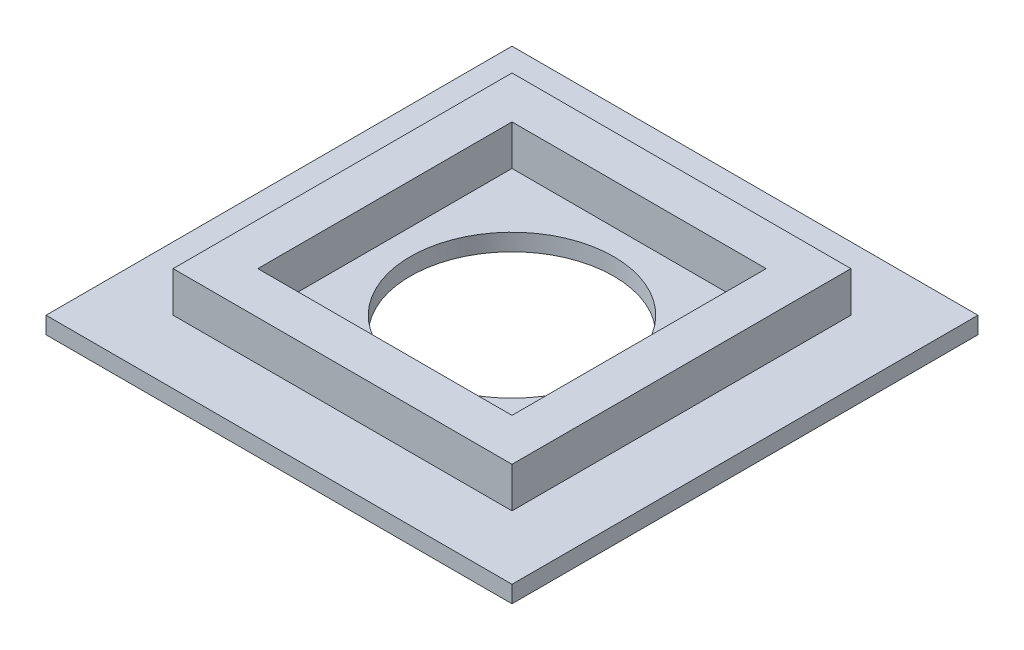
from build123d import *

# Parameters (mm, degrees)
SKETCH1_W           = 110
SKETCH1_H           = 110
BOSS_EXTRUDE1_DEPTH = 4
SKETCH2_W           = 80
SKETCH2_H           = 80
SKETCH2_W_2         = 60
SKETCH2_H_2         = 60
BOSS_EXTRUDE2_DEPTH = 9.525
SKETCH3_R           = 24.000000006
CUT_EXTRUDE1_DEPTH  = 20


with BuildPart() as part:
    # Sketch1 → Boss-Extrude1 (new body)
    with BuildSketch(Plane(origin=(0, 0, 0), x_dir=(1, 0, 0), z_dir=(0, 1, 0))):
        Rectangle(SKETCH1_W, SKETCH1_H)
    extrude(amount=-BOSS_EXTRUDE1_DEPTH)

    # Sketch2 → Boss-Extrude2 (add)
    with BuildSketch(Plane(origin=(0, 0, 0), x_dir=(1, 0, 0), z_dir=(0, 1, 0))):
        Rectangle(SKETCH2_W, SKETCH2_H)
        Rectangle(SKETCH2_W_2, SKETCH2_H_2, mode=Mode.SUBTRACT)
    extrude(amount=BOSS_EXTRUDE2_DEPTH)

    # Sketch3 → Cut-Extrude1 (cut)
    with BuildSketch(Plane(origin=(0, 0, 0), x_dir=(1, 0, 0), z_dir=(0, 1, 0))):
        Circle(SKETCH3_R)
    extrude(amount=-CUT_EXTRUDE1_DEPTH, mode=Mode.SUBTRACT)


solid = part.part
